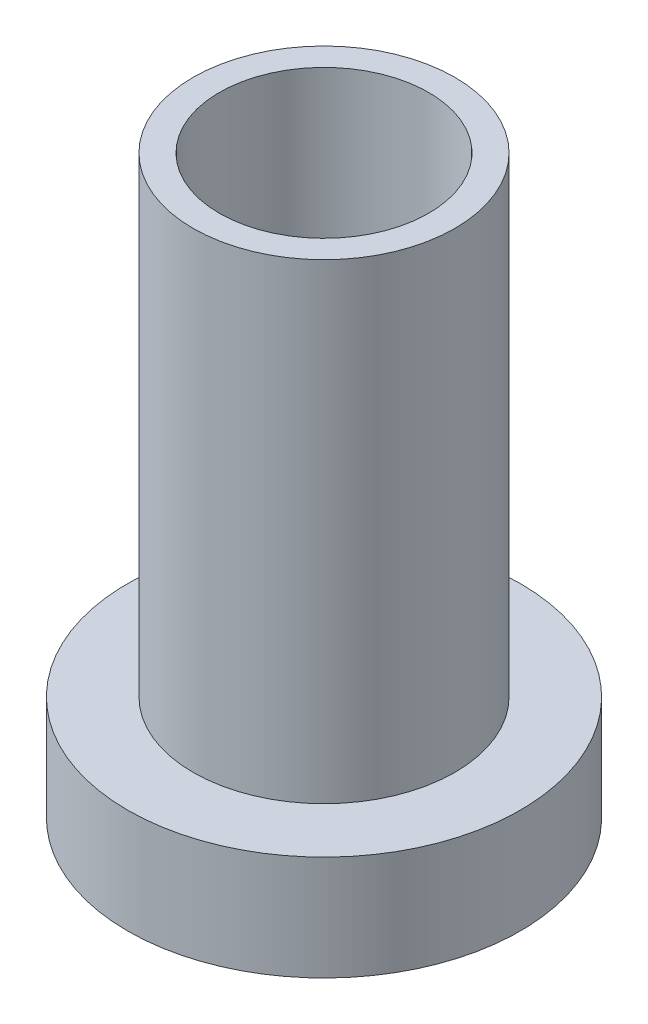
from build123d import *

# Parameters (mm, degrees)
SKETCH_1_R          = 7.5
EXTRUDE_1_DEPTH     = 4
SKETCH_3_R          = 5
EXTRUDE_2_DEPTH     = 18
SKETCH_4_R          = 4
CUT_EXTRUDE_1_DEPTH = 18


with BuildPart() as part:
    # Эскиз1 → Бобышка-Вытянуть1 (new body)
    with BuildSketch(Plane(origin=(0, 0, 0), x_dir=(1, 0, 0), z_dir=(0, 1, 0))):
        with Locations(Location((0, 0, 0), (0, 0, 270))):
            Circle(SKETCH_1_R)
    extrude(amount=EXTRUDE_1_DEPTH)

    # Эскиз3 → Бобышка-Вытянуть2 (add)
    with BuildSketch(Plane(origin=(0, 4, 0), x_dir=(1, 0, 0), z_dir=(0, 1, 0))):
        with Locations(Location((0, 0, 0), (0, 0, 270))):
            Circle(SKETCH_3_R)
    extrude(amount=EXTRUDE_2_DEPTH)

    # Эскиз4 → Вырез-Вытянуть1 (cut)
    with BuildSketch(Plane(origin=(0, 22, 0), x_dir=(1, 0, 0), z_dir=(0, 1, 0))):
        with Locations(Location((0, 0, 0), (0, 0, 270))):
            Circle(SKETCH_4_R)
    extrude(amount=-CUT_EXTRUDE_1_DEPTH, mode=Mode.SUBTRACT)


solid = part.part
